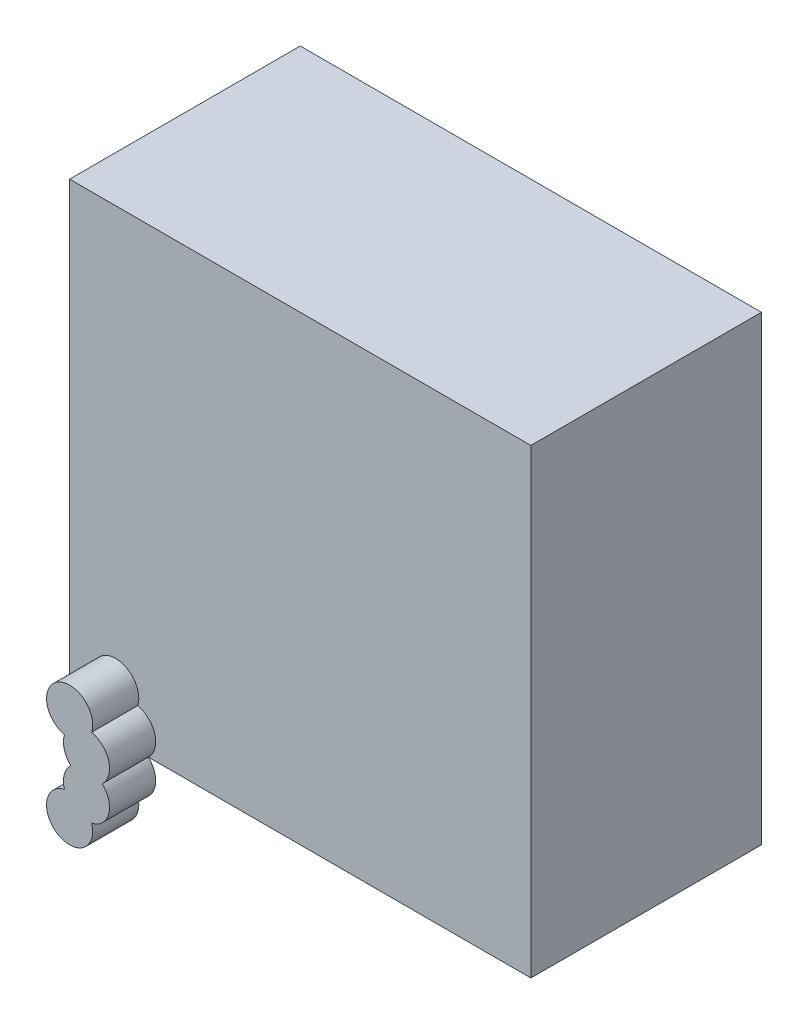
from build123d import *

# Parameters (mm, degrees)
SKETCH_1_W            = 20
SKETCH_1_H            = 20
BASEBOX_DEPTH         = 10
SKETCH_2_R            = 1
BOSSSEED_DEPTH        = 2
CIRCULARPATTERN_COUNT = 4
CIRCULARPATTERN_ANGLE = 90


with BuildPart() as part:
    # 草图1 → BaseBox (new body)
    with BuildSketch(Plane.XY):
        with Locations((10, 10)):
            Rectangle(SKETCH_1_W, SKETCH_1_H)
    extrude(amount=BASEBOX_DEPTH)

    # 草图2 → BossSeed (add)
    with BuildSketch(Plane.XY.offset(10)):
        with Locations((2, 2)):
            Circle(SKETCH_2_R)
    bossseed = extrude(amount=BOSSSEED_DEPTH)

    # CircularPattern: BossSeed ×4 about axis
    circularpattern_axis = Axis((0, 0, 0), (0, 0, -1))
    for i in range(1, CIRCULARPATTERN_COUNT):
        add(bossseed.rotate(circularpattern_axis, i * CIRCULARPATTERN_ANGLE / (CIRCULARPATTERN_COUNT - 1)))


solid = part.part
